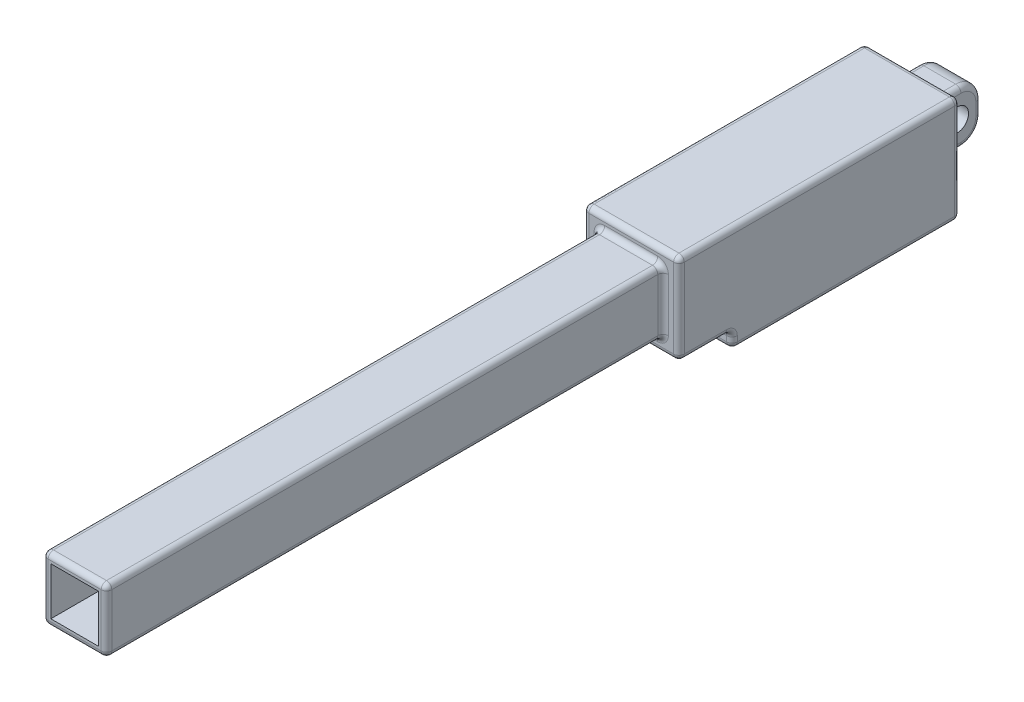
from build123d import *

# Parameters (mm, degrees)
ESQUISSE1_W             = 18
ESQUISSE1_H             = 20
EXTRUSION1_DEPTH        = 43
ESQUISSE4_W             = 18
ESQUISSE4_H             = 17
EXTRUSION3_DEPTH        = 10
ESQUISSE7_W             = 8
ESQUISSE7_H             = 10
EXTRUSION4_DEPTH        = 9
CONG_5_R                = 3.8
CONG_6_R                = 1
ESQUISSE8_R             = 2.125
ENL_V_MAT_EXTRU_1_DEPTH = 59.120564347
ESQUISSE6_W             = 12
ESQUISSE6_H             = 12
EXTRUSION5_DEPTH        = 105
CONG_7_R                = 1
ESQUISSE9_W             = 9
ESQUISSE9_H             = 9
ENL_V_MAT_EXTRU_2_DEPTH = 106


with BuildPart() as part:
    # Esquisse1 → Extrusion1 (new body)
    with BuildSketch(Plane.XY):
        with Locations((9, 10)):
            Rectangle(ESQUISSE1_W, ESQUISSE1_H)
    extrude(amount=EXTRUSION1_DEPTH)

    # Esquisse4 → Extrusion3 (add)
    with BuildSketch(Plane.XY.offset(43)):
        with Locations((9, 11.5)):
            Rectangle(ESQUISSE4_W, ESQUISSE4_H)
    extrude(amount=EXTRUSION3_DEPTH)

    # Esquisse7 → Extrusion4 (add)
    with BuildSketch(Plane(origin=(0, 0, 0), x_dir=(-1, 0, 0), z_dir=(0, 0, -1))):
        with Locations((-9, 11.5)):
            Rectangle(ESQUISSE7_W, ESQUISSE7_H)
    extrude(amount=EXTRUSION4_DEPTH)

    # Congé5
    cong_5_edges = [part.edges().sort_by_distance(p)[0] for p in [
        (9, 6.5, -9),
        (9, 16.5, -9),
    ]]
    fillet(cong_5_edges, radius=CONG_5_R)

    # Congé6
    cong_6_edges = [part.edges().sort_by_distance(p)[0] for p in [
        (18, 1.5, 43),
        (0, 1.5, 43),
        (18, 3, 48),
        (9, 3, 43),
        (0, 3, 48),
        (18, 11.5, 53),
        (9, 20, 53),
        (0, 11.5, 53),
        (9, 3, 53),
        (13, 11.5, 0),
        (9, 6.5, 0),
        (5, 11.5, 0),
        (9, 16.5, 0),
        (13, 11.5, -9),
        (5, 11.5, -9),
        (9, 20, 0),
        (5, 16.5, -2.6),
        (5, 6.5, -2.6),
        (5, 15.387005769, -7.887005769),
        (5, 7.612994231, -7.887005769),
        (13, 6.5, -2.6),
        (13, 16.5, -2.6),
        (13, 15.387005769, -7.887005769),
        (18, 10, 0),
        (13, 7.612994231, -7.887005769),
        (9, 0, 0),
        (0, 10, 0),
        (9, 0, 43),
        (0, 20, 26.5),
        (18, 20, 26.5),
        (18, 0, 21.5),
        (0, 0, 21.5),
    ]]
    fillet(cong_6_edges, radius=CONG_6_R)

    # Esquisse8 → Enlèv. mat.-Extru.1 (cut, through all)
    with BuildSketch(Plane.ZY.offset(-5)):
        with Locations(Location((-4.5, 11.5, 0), (0, 0, 270))):
            Circle(ESQUISSE8_R)
    extrude(amount=-ENL_V_MAT_EXTRU_1_DEPTH, mode=Mode.SUBTRACT)

    # Esquisse6 → Extrusion5 (add)
    with BuildSketch(Plane.XY.offset(53)):
        with Locations((9, 11.5)):
            Rectangle(ESQUISSE6_W, ESQUISSE6_H)
    extrude(amount=EXTRUSION5_DEPTH)

    # Congé7
    cong_7_edges = [part.edges().sort_by_distance(p)[0] for p in [
        (15, 11.5, 53),
        (15, 5.5, 105.5),
        (9, 17.5, 53),
        (15, 17.5, 105.5),
        (3, 11.5, 53),
        (3, 17.5, 105.5),
        (9, 5.5, 53),
        (3, 5.5, 105.5),
        (15, 11.5, 158),
        (9, 17.5, 158),
        (3, 11.5, 158),
        (9, 5.5, 158),
    ]]
    fillet(cong_7_edges, radius=CONG_7_R)

    # Esquisse9 → Enlèv. mat.-Extru.2 (cut)
    with BuildSketch(Plane.XY.offset(158)):
        with Locations((9, 11.5)):
            Rectangle(ESQUISSE9_W, ESQUISSE9_H)
    extrude(amount=-ENL_V_MAT_EXTRU_2_DEPTH, mode=Mode.SUBTRACT)


solid = part.part
